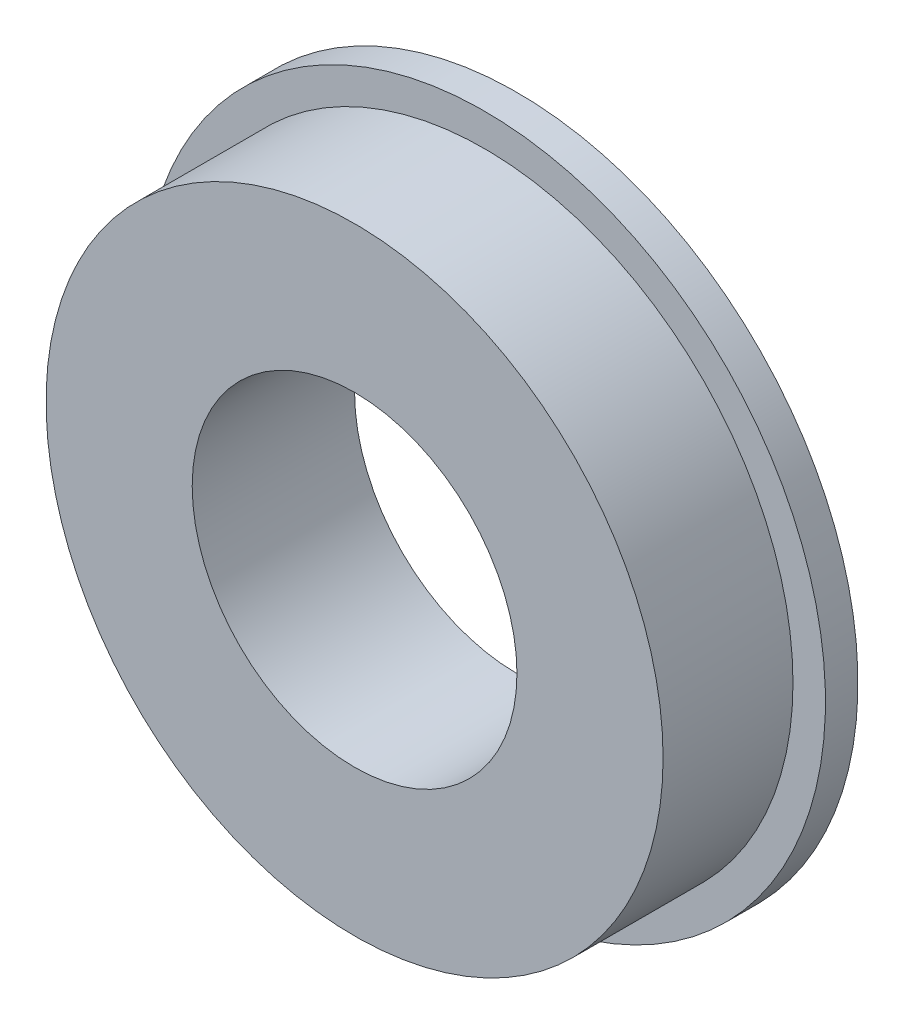
from build123d import *
from build123d.topology import SkipClean

# Parameters (mm, degrees)
SKETCH_1_R      = 9.5
SKETCH_1_R_2    = 5
EXTRUDE_1_DEPTH = 4
EXTRUDE_START   = 1
SKETCH_2_R      = 10.5
SKETCH_2_R_2    = 5
EXTRUDE_2_DEPTH = 1


with BuildPart() as part:
    # 草图1 → 凸台-拉伸1 (new body)
    with BuildSketch(Plane.XY):
        Circle(SKETCH_1_R)
        Circle(SKETCH_1_R_2, mode=Mode.SUBTRACT)
    extrude(amount=EXTRUDE_1_DEPTH)

    # 草图2 → 凸台-拉伸2 (add)
    with SkipClean():  # the faces are left unmerged after this step: merging them gives an invalid solid
        with BuildSketch(Plane(origin=(0, 0, 0), x_dir=(-1, 0, 0), z_dir=(0, 0, -1)).offset(EXTRUDE_START)):
            Circle(SKETCH_2_R)
            Circle(SKETCH_2_R_2, mode=Mode.SUBTRACT)
        extrude(amount=-EXTRUDE_2_DEPTH)


solid = part.part
